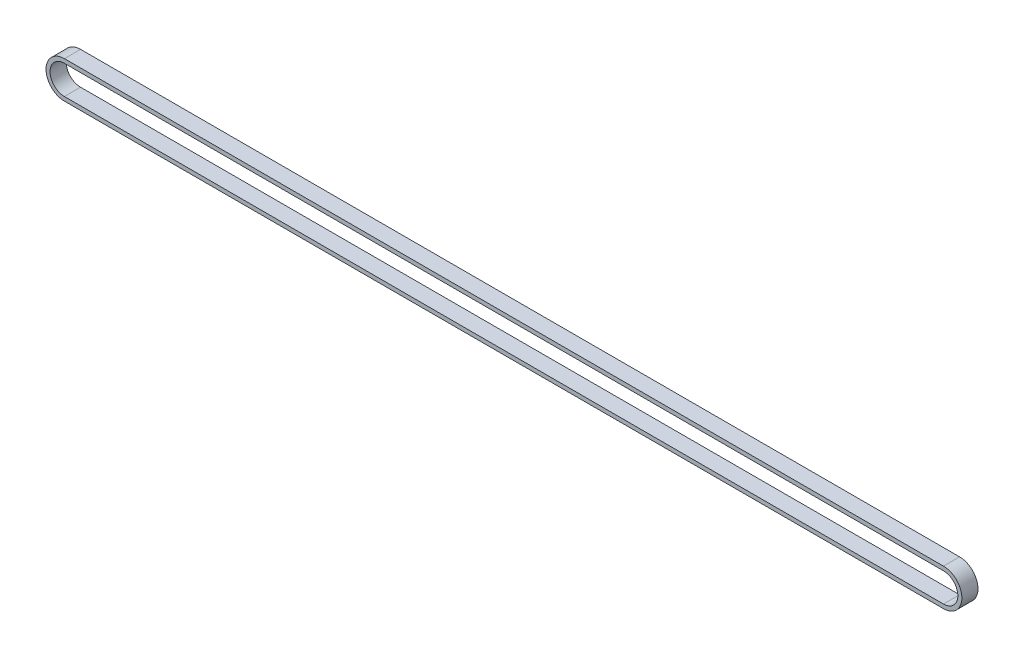
from build123d import *

# Parameters (mm, degrees)
EXTRUDE_THIN1_DEPTH = 3


with BuildPart() as part:
    # Sketch1 → Extrude-Thin1 (new, symmetric)
    with BuildSketch(Plane.XY):
        with BuildLine():
            Line((163.5, -6.85), (-163.5, -6.85))
            ThreePointArc((-163.5, -6.85), (-170.35, 0), (-163.5, 6.85))
            Line((-163.5, 6.85), (163.5, 6.85))
            ThreePointArc((163.5, 6.85), (170.35, 0), (163.5, -6.85))
        make_face()
        with BuildLine():
            Line((163.5, -5.35), (-163.5, -5.35))
            ThreePointArc((-163.5, -5.35), (-168.85, 0), (-163.5, 5.35))
            Line((-163.5, 5.35), (163.5, 5.35))
            ThreePointArc((163.5, 5.35), (168.85, 0), (163.5, -5.35))
        make_face(mode=Mode.SUBTRACT)
    extrude(amount=EXTRUDE_THIN1_DEPTH, both=True)


solid = part.part
